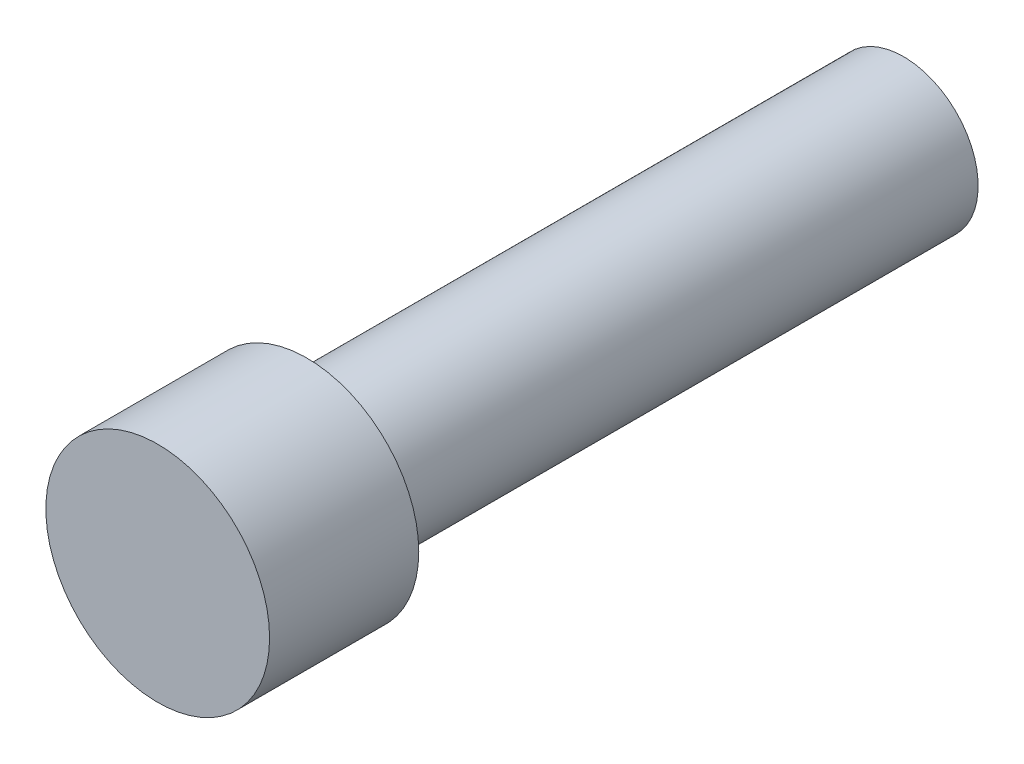
from build123d import *

# Parameters (mm, degrees)
SKETCH_1_R      = 1.5
EXTRUDE_1_DEPTH = 2
SKETCH_2_R      = 1
EXTRUDE_3_DEPTH = 8


with BuildPart() as part:
    # 草图1 → 凸台-拉伸1 (new body)
    with BuildSketch(Plane.XY):
        Circle(SKETCH_1_R)
    extrude(amount=EXTRUDE_1_DEPTH)

    # 草图2 → 凸台-拉伸3 (add)
    with BuildSketch(Plane(origin=(0, 0, 0), x_dir=(-1, 0, 0), z_dir=(0, 0, -1))):
        Circle(SKETCH_2_R)
    extrude(amount=EXTRUDE_3_DEPTH)


solid = part.part
